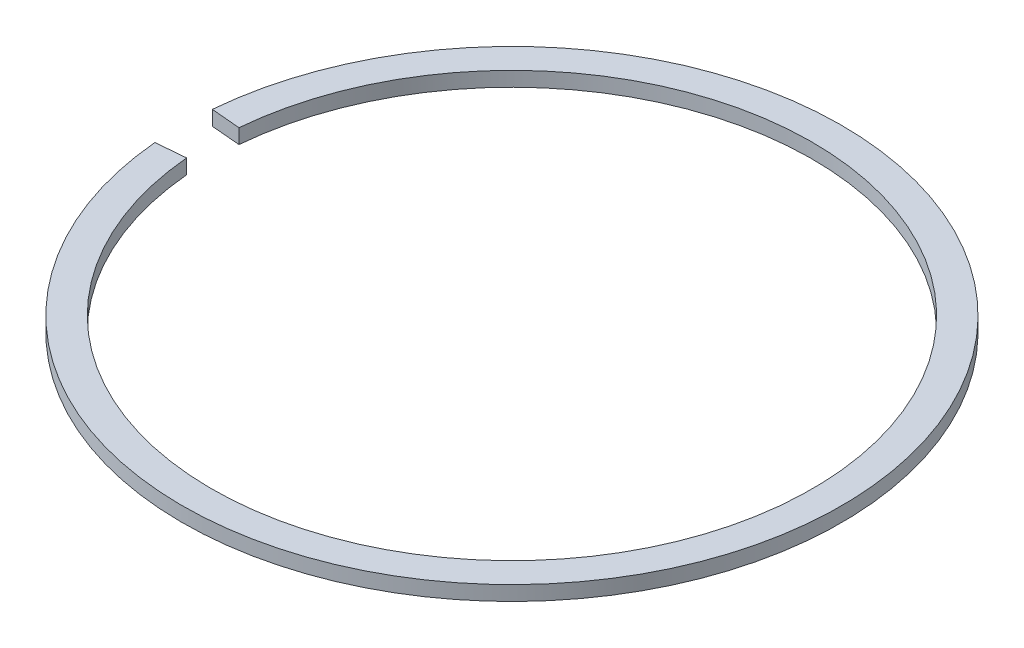
from build123d import *
from build123d.topology import SkipClean

# Parameters (mm, degrees)
SKETCH1_W      = 4
SKETCH1_H      = 2
REVOLVE1_ANGLE = 350


with BuildPart() as part:
    # Sketch1 → Revolve1 (revolve, symmetric)
    with SkipClean():  # the faces are left unmerged after this step: merging them gives an invalid solid
        with BuildSketch(Plane.XY) as revolve1_sk:
            with Locations((43, 1)):
                Rectangle(SKETCH1_W, SKETCH1_H)
        revolve(axis=Axis((0, 0, 0), (0, 1, 0)), revolution_arc=REVOLVE1_ANGLE / 2)
        revolve(revolve1_sk.sketch, axis=Axis((0, 0, 0), (0, -1, 0)), revolution_arc=REVOLVE1_ANGLE / 2)


solid = part.part
